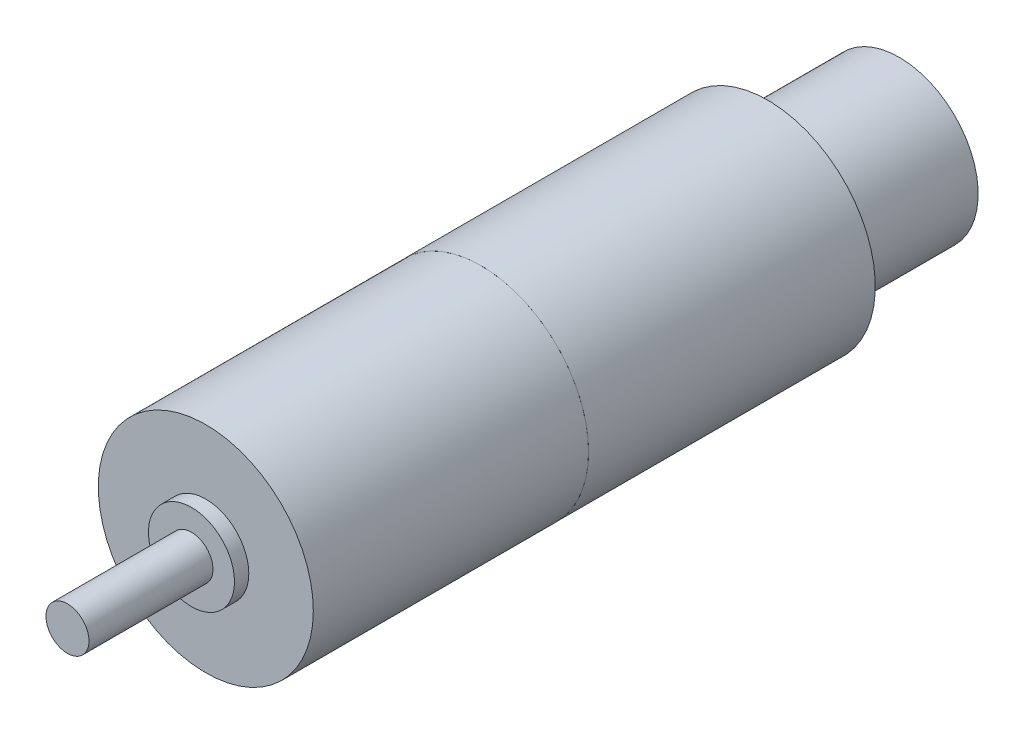
from build123d import *

# Parameters (mm, degrees)
SKETCH1_R           = 15
BOSS_EXTRUDE1_DEPTH = 38.4
SKETCH2_R           = 15
BOSS_EXTRUDE2_DEPTH = 40
SKETCH3_R           = 6
BOSS_EXTRUDE3_DEPTH = 2
SKETCH4_R           = 11
BOSS_EXTRUDE4_DEPTH = 18.35
SKETCH5_R           = 3
BOSS_EXTRUDE5_DEPTH = 17.3


with BuildPart() as part:
    # Sketch1 → Boss-Extrude1 (new body)
    with BuildSketch(Plane.XY):
        Circle(SKETCH1_R)
    extrude(amount=BOSS_EXTRUDE1_DEPTH)

    # Sketch3 → Boss-Extrude3 (add)
    with BuildSketch(Plane.XY.offset(38.4)):
        Circle(SKETCH3_R)
    extrude(amount=BOSS_EXTRUDE3_DEPTH)


with BuildPart() as body_2:
    # Sketch2 → Boss-Extrude2 (new body)
    with BuildSketch(Plane(origin=(0, 0, 0), x_dir=(-1, 0, 0), z_dir=(0, 0, -1))):
        Circle(SKETCH2_R)
    extrude(amount=BOSS_EXTRUDE2_DEPTH)


with BuildPart() as body_3:
    # Sketch4 → Boss-Extrude4 (new body)
    with BuildSketch(Plane(origin=(0, 0, -40), x_dir=(-1, 0, 0), z_dir=(0, 0, -1))):
        Circle(SKETCH4_R)
    extrude(amount=BOSS_EXTRUDE4_DEPTH)


with BuildPart() as body_4:
    # Sketch5 → Boss-Extrude5 (new body)
    with BuildSketch(Plane.XY.offset(40.4)):
        Circle(SKETCH5_R)
    extrude(amount=BOSS_EXTRUDE5_DEPTH)


solid = Compound([part.part, body_2.part, body_3.part, body_4.part])
